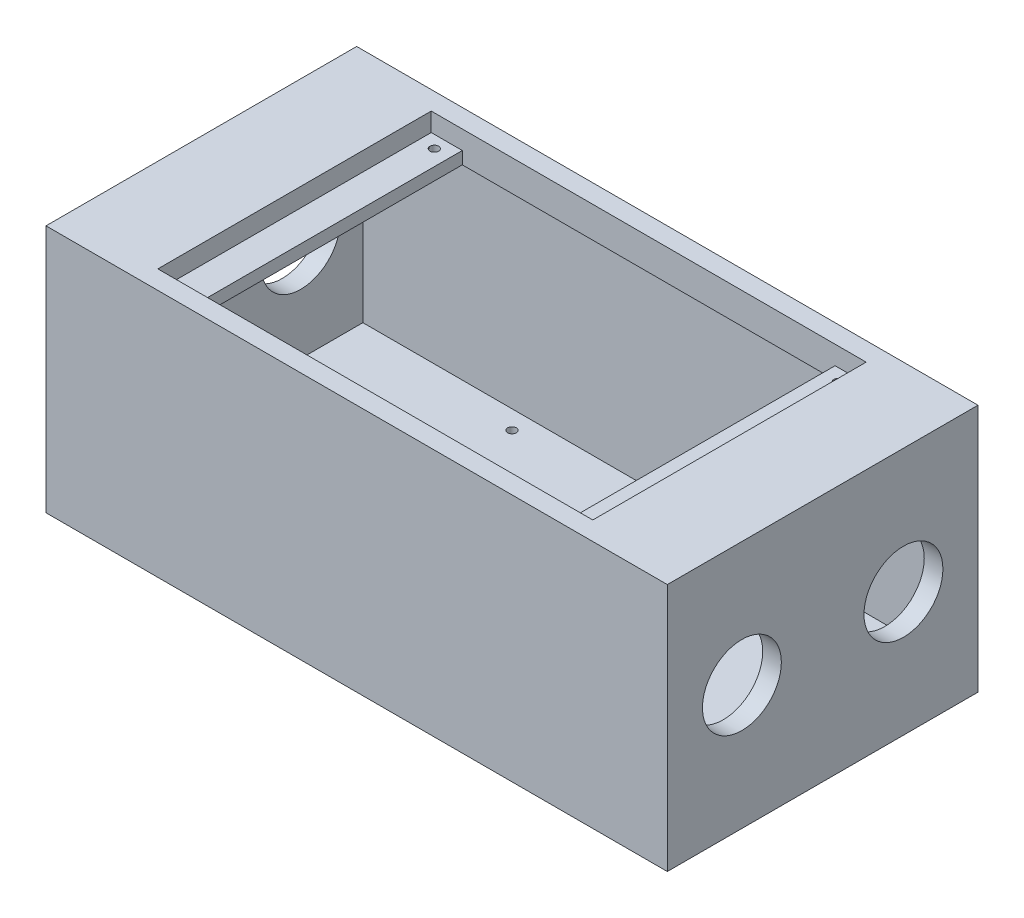
from build123d import *

# Parameters (mm, degrees)
SKETCH1_W                = 250
SKETCH1_H                = 200
BOSS_EXTRUDE1_DEPTH      = 250
SKETCH7_W                = 470
SKETCH7_H                = 230
CUT_EXTRUDE4_DEPTH       = 80
SKETCH5_R                = 31.75
F_63_5MM_DIA_SERVO_DEPTH = 20
MIRROR13_COPY_1_SKETCH_R = 31.75
MIRROR13_COPY_1_DEPTH    = 20
SKETCH10_W               = 350
SKETCH10_H               = 220
CUT_EXTRUDE5_DEPTH       = 20
SKETCH15_W               = 500
SKETCH15_H               = 250
BOSS_EXTRUDE2_DEPTH      = 10
SKETCH18_W               = 300
SKETCH18_H               = 220
CUT_EXTRUDE11_DEPTH      = 10
SKETCH19_R               = 3.5
CUT_EXTRUDE12_DEPTH      = 10
MIRROR15_COPY_1_SKETCH_R = 3.5
MIRROR15_COPY_1_DEPTH    = 10
SKETCH20_R               = 3.5
CUT_EXTRUDE13_DEPTH      = 10
MIRROR17_COPY_1_SKETCH_R = 3.5
MIRROR17_COPY_1_DEPTH    = 10


with BuildPart() as part:
    # Sketch1 → Boss-Extrude1 (new, symmetric)
    with BuildSketch(Plane(origin=(0, 0, 0), x_dir=(0, 0, -1), z_dir=(1, 0, 0))):
        Rectangle(SKETCH1_W, SKETCH1_H)
    extrude(amount=BOSS_EXTRUDE1_DEPTH, both=True)

    # Sketch7 → Cut-Extrude4 (cut, symmetric)
    with BuildSketch(Plane(origin=(0, 0, 0), x_dir=(1, 0, 0), z_dir=(0, 1, 0))):
        Rectangle(SKETCH7_W, SKETCH7_H)
    extrude(amount=CUT_EXTRUDE4_DEPTH, both=True, mode=Mode.SUBTRACT)

    # Sketch5 → 63.5mm_dia_servo (cut)
    with BuildSketch(Plane(origin=(250, 0, 0), x_dir=(0, 0, -1), z_dir=(1, 0, 0))):
        with Locations((-65, 0)):
            Circle(SKETCH5_R)
    f_63_5mm_dia_servo = extrude(amount=-F_63_5MM_DIA_SERVO_DEPTH, mode=Mode.SUBTRACT)

    # Mirror12: 63.5mm_dia_servo across plane
    add(f_63_5mm_dia_servo.mirror(Plane.XY), mode=Mode.SUBTRACT)

    # Mirror13: 63.5mm_dia_servo across plane
    add(f_63_5mm_dia_servo.mirror(Plane(origin=(0, 0, 0), x_dir=(0, 0, 1), z_dir=(1, 0, 0))), mode=Mode.SUBTRACT)

    # Mirror13 copy 1 sketch → Mirror13 copy 1 (cut)
    with BuildSketch(Plane.ZY.offset(250)):
        with Locations((-65, 0)):
            Circle(MIRROR13_COPY_1_SKETCH_R)
    extrude(amount=-MIRROR13_COPY_1_DEPTH, mode=Mode.SUBTRACT)

    # Sketch10 → Cut-Extrude5 (cut)
    with BuildSketch(Plane(origin=(0, 100, 0), x_dir=(1, 0, 0), z_dir=(0, 1, 0))):
        Rectangle(SKETCH10_W, SKETCH10_H)
    extrude(amount=-CUT_EXTRUDE5_DEPTH, mode=Mode.SUBTRACT)

    # Sketch15 → Boss-Extrude2 (add)
    with BuildSketch(Plane(origin=(0, 75, 0), x_dir=(1, 0, 0), z_dir=(0, 1, 0))):
        Rectangle(SKETCH15_W, SKETCH15_H)
    extrude(amount=BOSS_EXTRUDE2_DEPTH)

    # Sketch18 → Cut-Extrude11 (cut)
    with BuildSketch(Plane(origin=(0, 85, 0), x_dir=(1, 0, 0), z_dir=(0, 1, 0))):
        Rectangle(SKETCH18_W, SKETCH18_H)
    extrude(amount=-CUT_EXTRUDE11_DEPTH, mode=Mode.SUBTRACT)

    # Sketch19 → Cut-Extrude12 (cut)
    with BuildSketch(Plane(origin=(0, 85, 0), x_dir=(1, 0, 0), z_dir=(0, 1, 0))):
        with Locations(Location((-162.5, 100, 0), (0, 0, 270))):
            Circle(SKETCH19_R)
    cut_extrude12 = extrude(amount=-CUT_EXTRUDE12_DEPTH, mode=Mode.SUBTRACT)

    # Mirror14: Cut-Extrude12 across plane
    add(cut_extrude12.mirror(Plane.XY), mode=Mode.SUBTRACT)

    # Mirror15: Cut-Extrude12 across plane
    add(cut_extrude12.mirror(Plane(origin=(0, 0, 0), x_dir=(0, 0, 1), z_dir=(1, 0, 0))), mode=Mode.SUBTRACT)

    # Mirror15 copy 1 sketch → Mirror15 copy 1 (cut)
    with BuildSketch(Plane(origin=(0, 85, 0), x_dir=(-1, 0, 0), z_dir=(0, 1, 0))):
        with Locations(Location((-162.5, 100, 0), (0, 0, 270))):
            Circle(MIRROR15_COPY_1_SKETCH_R)
    extrude(amount=-MIRROR15_COPY_1_DEPTH, mode=Mode.SUBTRACT)

    # Sketch20 → Cut-Extrude13 (cut)
    with BuildSketch(Plane(origin=(0, -80, 0), x_dir=(1, 0, 0), z_dir=(0, 1, 0))):
        with Locations(Location((-100, 100, 0), (0, 0, 270))):
            Circle(SKETCH20_R)
    cut_extrude13 = extrude(amount=-CUT_EXTRUDE13_DEPTH, mode=Mode.SUBTRACT)

    # Mirror16: Cut-Extrude13 across plane
    add(cut_extrude13.mirror(Plane.XY), mode=Mode.SUBTRACT)

    # Mirror17: Cut-Extrude13 across plane
    add(cut_extrude13.mirror(Plane(origin=(0, 0, 0), x_dir=(0, 0, 1), z_dir=(1, 0, 0))), mode=Mode.SUBTRACT)

    # Mirror17 copy 1 sketch → Mirror17 copy 1 (cut)
    with BuildSketch(Plane(origin=(0, -80, 0), x_dir=(-1, 0, 0), z_dir=(0, 1, 0))):
        with Locations(Location((-100, 100, 0), (0, 0, 270))):
            Circle(MIRROR17_COPY_1_SKETCH_R)
    extrude(amount=-MIRROR17_COPY_1_DEPTH, mode=Mode.SUBTRACT)


solid = part.part
